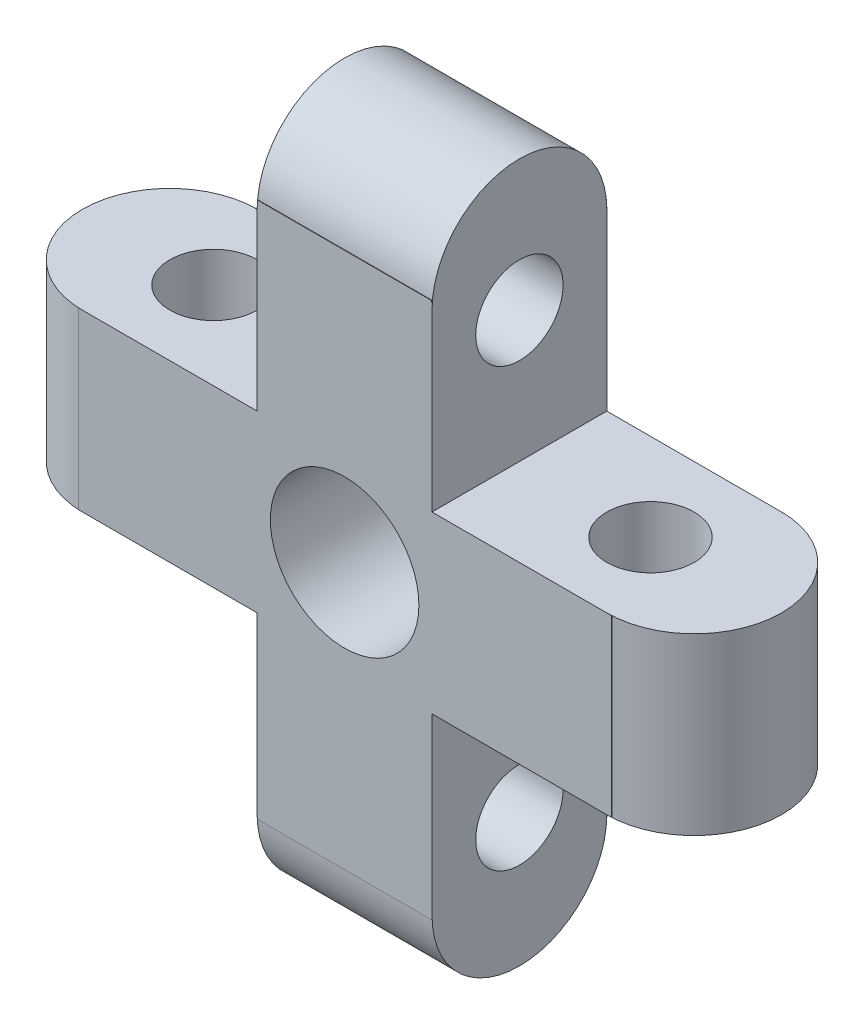
from build123d import *

# Parameters (mm, degrees)
EXTRUDE_1_DEPTH     = 10
CUT_EXTRUDE_1_DEPTH = 10
CUT_EXTRUDE_2_DEPTH = 10
CUT_EXTRUDE_3_DEPTH = 10
CUT_EXTRUDE_4_DEPTH = 10
CUT_EXTRUDE_5_DEPTH = 10
SKETCH_8_R          = 4.25
SKETCH_8_R_2        = 3
CUT_EXTRUDE_6_DEPTH = 38.252521334
SKETCH_9_W          = 10
SKETCH_9_H          = 4.534386639
CUT_EXTRUDE_7_DEPTH = 37.39158883
EXTRUDE_2_DEPTH     = 10
SKETCH_12_W         = 10
SKETCH_12_H         = 4.781714723
CUT_EXTRUDE_8_DEPTH = 37.39158883
EXTRUDE_3_DEPTH     = 10
SKETCH_15_W         = 4.719326728
SKETCH_15_H         = 10
SKETCH_15_W_2       = 4.766273505
CUT_EXTRUDE_9_DEPTH = 38.595247149
EXTRUDE_4_DEPTH     = 10


with BuildPart() as part:
    # 草图2 → 凸台-拉伸1 (new body)
    with BuildSketch(Plane.XY):
        with BuildLine():
            Line((1.237427622, 9.481579556), (1.237427622, 19.481579556))
            ThreePointArc((1.237427622, 19.481579556), (6.237427622, 24.481579556), (11.237427622, 19.481579556))
            Line((11.237427622, 19.481579556), (11.237427622, 9.481579556))
            Line((11.237427622, 9.481579556), (21.237427622, 9.481579556))
            ThreePointArc((21.237427622, 9.481579556), (26.237427622, 4.481579556), (21.237427622, -0.518420444))
            Line((21.237427622, -0.518420444), (11.237427622, -0.518420444))
            Line((11.237427622, -0.518420444), (11.237427622, -10.518420444))
            ThreePointArc((11.237427622, -10.518420444), (6.237427622, -15.518420444), (1.237427622, -10.518420444))
            Line((1.237427622, -10.518420444), (1.237427622, -0.518420444))
            Line((1.237427622, -0.518420444), (-8.762572378, -0.518420444))
            ThreePointArc((-8.762572378, -0.518420444), (-13.762572378, 4.481579556), (-8.762572378, 9.481579556))
            Line((-8.762572378, 9.481579556), (1.237427622, 9.481579556))
        make_face()
    extrude(amount=EXTRUDE_1_DEPTH)

    # 草图3 → 切除-拉伸1 (cut)
    with BuildSketch(Plane.XZ.offset(0.518420444)):
        with BuildLine():
            ThreePointArc((-8.342698114, 3.613249509), (-6.262572378, 2.5), (-4.182446643, 3.613249509))
            Line((-4.182446643, 3.613249509), (-6.262572378, 5))
            Line((-6.262572378, 5), (-8.342698114, 3.613249509))
        make_face()
        with BuildLine():
            Line((-6.262572378, 5), (-4.182446643, 3.613249509))
            ThreePointArc((-4.182446643, 3.613249509), (-3.869842312, 4.275539628), (-3.762572378, 5))
            ThreePointArc((-3.762572378, 5), (-3.869842312, 5.724460372), (-4.182446643, 6.386750491))
            Line((-4.182446643, 6.386750491), (-6.262572378, 5))
        make_face()
        with BuildLine():
            ThreePointArc((-8.342698114, 6.386750491), (-8.655302445, 5.724460372), (-8.762572378, 5))
            ThreePointArc((-8.762572378, 5), (-8.655302445, 4.275539628), (-8.342698114, 3.613249509))
            Line((-8.342698114, 3.613249509), (-6.262572378, 5))
            Line((-6.262572378, 5), (-8.342698114, 6.386750491))
        make_face()
        with BuildLine():
            Line((-6.262572378, 5), (-4.182446643, 6.386750491))
            ThreePointArc((-4.182446643, 6.386750491), (-6.262572378, 7.5), (-8.342698114, 6.386750491))
            Line((-8.342698114, 6.386750491), (-6.262572378, 5))
        make_face()
    extrude(amount=-CUT_EXTRUDE_1_DEPTH, mode=Mode.SUBTRACT)

    # 草图4 → 切除-拉伸2 (cut)
    with BuildSketch(Plane(origin=(11.237427622, 0, 0), x_dir=(0, 0, -1), z_dir=(1, 0, 0))):
        with BuildLine():
            ThreePointArc((-6.386750491, -10.09854618), (-5.724460372, -10.411150511), (-5, -10.518420444))
            ThreePointArc((-5, -10.518420444), (-4.275539628, -10.411150511), (-3.613249509, -10.09854618))
            Line((-3.613249509, -10.09854618), (-5, -8.018420444))
            Line((-5, -8.018420444), (-6.386750491, -10.09854618))
        make_face()
        with BuildLine():
            Line((-5, -8.018420444), (-3.613249509, -10.09854618))
            ThreePointArc((-3.613249509, -10.09854618), (-2.795813503, -9.198065258), (-2.5, -8.018420444))
            ThreePointArc((-2.5, -8.018420444), (-2.795813503, -6.83877563), (-3.613249509, -5.938294708))
            Line((-3.613249509, -5.938294708), (-5, -8.018420444))
        make_face()
        with BuildLine():
            Line((-5, -8.018420444), (-3.613249509, -5.938294708))
            ThreePointArc((-3.613249509, -5.938294708), (-5, -5.518420444), (-6.386750491, -5.938294708))
            Line((-6.386750491, -5.938294708), (-5, -8.018420444))
        make_face()
        with BuildLine():
            ThreePointArc((-6.386750491, -5.938294708), (-7.5, -8.018420444), (-6.386750491, -10.09854618))
            Line((-6.386750491, -10.09854618), (-5, -8.018420444))
            Line((-5, -8.018420444), (-6.386750491, -5.938294708))
        make_face()
    extrude(amount=-CUT_EXTRUDE_2_DEPTH, mode=Mode.SUBTRACT)

    # 草图5 → 切除-拉伸3 (cut)
    with BuildSketch(Plane(origin=(0, 9.481579556, 0), x_dir=(1, 0, 0), z_dir=(0, 1, 0))):
        with BuildLine():
            ThreePointArc((20.817553357, -6.386750491), (21.130157688, -5.724460372), (21.237427622, -5))
            ThreePointArc((21.237427622, -5), (21.130157688, -4.275539628), (20.817553357, -3.613249509))
            Line((20.817553357, -3.613249509), (18.737427622, -5))
            Line((18.737427622, -5), (20.817553357, -6.386750491))
        make_face()
        with BuildLine():
            Line((18.737427622, -5), (20.817553357, -3.613249509))
            ThreePointArc((20.817553357, -3.613249509), (18.737427622, -2.5), (16.657301886, -3.613249509))
            Line((16.657301886, -3.613249509), (18.737427622, -5))
        make_face()
        with BuildLine():
            Line((18.737427622, -5), (16.657301886, -3.613249509))
            ThreePointArc((16.657301886, -3.613249509), (16.237427622, -5), (16.657301886, -6.386750491))
            Line((16.657301886, -6.386750491), (18.737427622, -5))
        make_face()
        with BuildLine():
            ThreePointArc((16.657301886, -6.386750491), (18.737427622, -7.5), (20.817553357, -6.386750491))
            Line((20.817553357, -6.386750491), (18.737427622, -5))
            Line((18.737427622, -5), (16.657301886, -6.386750491))
        make_face()
    extrude(amount=-CUT_EXTRUDE_3_DEPTH, mode=Mode.SUBTRACT)

    # 草图6 → 切除-拉伸4 (cut)
    with BuildSketch(Plane.ZY.offset(-1.237427622)):
        with BuildLine():
            ThreePointArc((6.386750491, 19.061705292), (5, 19.481579556), (3.613249509, 19.061705292))
            Line((3.613249509, 19.061705292), (5, 16.981579556))
            Line((5, 16.981579556), (6.386750491, 19.061705292))
        make_face()
        with BuildLine():
            Line((5, 16.981579556), (3.613249509, 19.061705292))
            ThreePointArc((3.613249509, 19.061705292), (2.5, 16.981579556), (3.613249509, 14.90145382))
            Line((3.613249509, 14.90145382), (5, 16.981579556))
        make_face()
        with BuildLine():
            Line((6.386750491, 14.90145382), (5, 16.981579556))
            Line((5, 16.981579556), (3.613249509, 14.90145382))
            ThreePointArc((3.613249509, 14.90145382), (5, 14.481579556), (6.386750491, 14.90145382))
        make_face()
        with BuildLine():
            Line((6.386750491, 19.061705292), (5, 16.981579556))
            Line((5, 16.981579556), (6.386750491, 14.90145382))
            ThreePointArc((6.386750491, 14.90145382), (7.204186497, 15.801934742), (7.5, 16.981579556))
            ThreePointArc((7.5, 16.981579556), (7.204186497, 18.16122437), (6.386750491, 19.061705292))
        make_face()
    extrude(amount=-CUT_EXTRUDE_4_DEPTH, mode=Mode.SUBTRACT)

    # 草图7 → 切除-拉伸5 (cut)
    with BuildSketch(Plane.XY.offset(10)):
        with BuildLine():
            ThreePointArc((9.237427622, 4.481579556), (9.009066219, 5.629629853), (8.358747965, 6.602899899))
            Line((8.358747965, 6.602899899), (6.237427622, 4.481579556))
            Line((6.237427622, 4.481579556), (8.358747965, 2.360259212))
            ThreePointArc((8.358747965, 2.360259212), (9.009066219, 3.333529259), (9.237427622, 4.481579556))
        make_face()
        with BuildLine():
            Line((6.237427622, 4.481579556), (8.358747965, 6.602899899))
            ThreePointArc((8.358747965, 6.602899899), (6.237427622, 7.481579556), (4.116107278, 6.602899899))
            Line((4.116107278, 6.602899899), (6.237427622, 4.481579556))
        make_face()
        with BuildLine():
            Line((8.358747965, 2.360259212), (6.237427622, 4.481579556))
            Line((6.237427622, 4.481579556), (4.116107278, 2.360259212))
            ThreePointArc((4.116107278, 2.360259212), (6.237427622, 1.481579556), (8.358747965, 2.360259212))
        make_face()
        with BuildLine():
            Line((4.116107278, 2.360259212), (6.237427622, 4.481579556))
            Line((6.237427622, 4.481579556), (4.116107278, 6.602899899))
            ThreePointArc((4.116107278, 6.602899899), (3.237427622, 4.481579556), (4.116107278, 2.360259212))
        make_face()
    extrude(amount=-CUT_EXTRUDE_5_DEPTH, mode=Mode.SUBTRACT)

    # 草图8 → 切除-拉伸6 (cut, through all)
    with BuildSketch(Plane.XY.offset(10)):
        with Locations((6.237427622, 4.481579556)):
            Circle(SKETCH_8_R)
        with Locations((6.237427622, 4.481579556)):
            Circle(SKETCH_8_R_2, mode=Mode.SUBTRACT)
    extrude(amount=-CUT_EXTRUDE_6_DEPTH, mode=Mode.SUBTRACT)

    # 草图9 → 切除-拉伸7 (cut, through all)
    with BuildSketch(Plane.ZY.offset(-1.237427622)):
        with Locations((5, 22.214386237)):
            Rectangle(SKETCH_9_W, SKETCH_9_H)
    extrude(amount=-CUT_EXTRUDE_7_DEPTH, mode=Mode.SUBTRACT)

    # 草图10 → 凸台-拉伸2 (add)
    with BuildSketch(Plane.ZY.offset(-1.237427622)):
        with BuildLine():
            Line((10, 19.481579556), (5, 19.481579556))
            Line((5, 19.481579556), (0, 19.481579556))
            ThreePointArc((0, 19.481579556), (5, 24.481579556), (10, 19.481579556))
        make_face()
    extrude(amount=-EXTRUDE_2_DEPTH)

    # 草图12 → 切除-拉伸8 (cut, through all)
    with BuildSketch(Plane.ZY.offset(-1.237427622)):
        with Locations((5, -13.127563083)):
            Rectangle(SKETCH_12_W, SKETCH_12_H)
    extrude(amount=-CUT_EXTRUDE_8_DEPTH, mode=Mode.SUBTRACT)

    # 草图13 → 凸台-拉伸3 (add)
    with BuildSketch(Plane.ZY.offset(-1.237427622)):
        with BuildLine():
            Line((10, -10.518420444), (5, -10.518420444))
            Line((5, -10.518420444), (0, -10.518420444))
            ThreePointArc((0, -10.518420444), (5, -15.518420444), (10, -10.518420444))
        make_face()
    extrude(amount=-EXTRUDE_3_DEPTH)

    # 草图15 → 切除-拉伸9 (cut, through all)
    with BuildSketch(Plane(origin=(0, 9.481579556, 0), x_dir=(1, 0, 0), z_dir=(0, 1, 0))):
        with Locations((23.877764258, -5)):
            Rectangle(SKETCH_15_W, SKETCH_15_H)
        with Locations((-11.379435626, -5)):
            Rectangle(SKETCH_15_W_2, SKETCH_15_H)
    extrude(amount=-CUT_EXTRUDE_9_DEPTH, mode=Mode.SUBTRACT)

    # 草图16 → 凸台-拉伸4 (add)
    with BuildSketch(Plane(origin=(0, 9.481579556, 0), x_dir=(1, 0, 0), z_dir=(0, 1, 0))):
        with BuildLine():
            Line((21.237427622, -5), (21.237427622, 0))
            ThreePointArc((21.237427622, 0), (26.237427622, -5), (21.237427622, -10))
            Line((21.237427622, -10), (21.237427622, -5))
        make_face()
        with BuildLine():
            Line((-8.762572378, -5), (-8.762572378, 0))
            ThreePointArc((-8.762572378, 0), (-13.762572378, -5), (-8.762572378, -10))
            Line((-8.762572378, -10), (-8.762572378, -5))
        make_face()
    extrude(amount=-EXTRUDE_4_DEPTH)


solid = part.part
